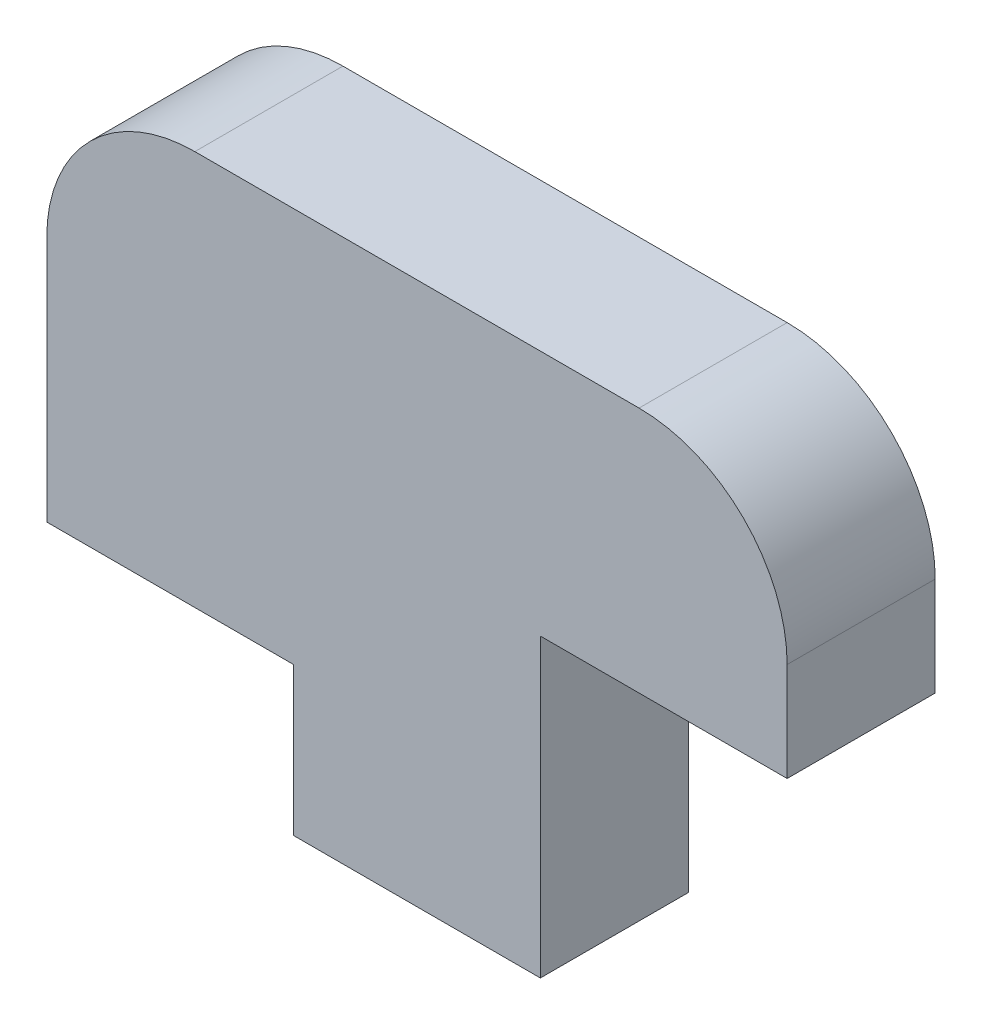
from build123d import *

# Parameters (mm, degrees)
BOSS_EXTRUDE1_DEPTH = 3


with BuildPart() as part:
    # Sketch1 → Boss-Extrude1 (new body)
    with BuildSketch(Plane.XY):
        with BuildLine():
            Line((-5, 3), (-5, 0))
            Line((-5, 0), (0, 0))
            Line((0, 0), (0, 6))
            Line((0, 6), (5, 6))
            Line((5, 6), (5, 8))
            ThreePointArc((5, 8), (4.121320344, 10.121320344), (2, 11))
            Line((2, 11), (-7, 11))
            ThreePointArc((-7, 11), (-9.121320344, 10.121320344), (-10, 8))
            Line((-10, 8), (-10, 3))
            Line((-10, 3), (-5, 3))
        make_face()
    extrude(amount=BOSS_EXTRUDE1_DEPTH)


solid = part.part
